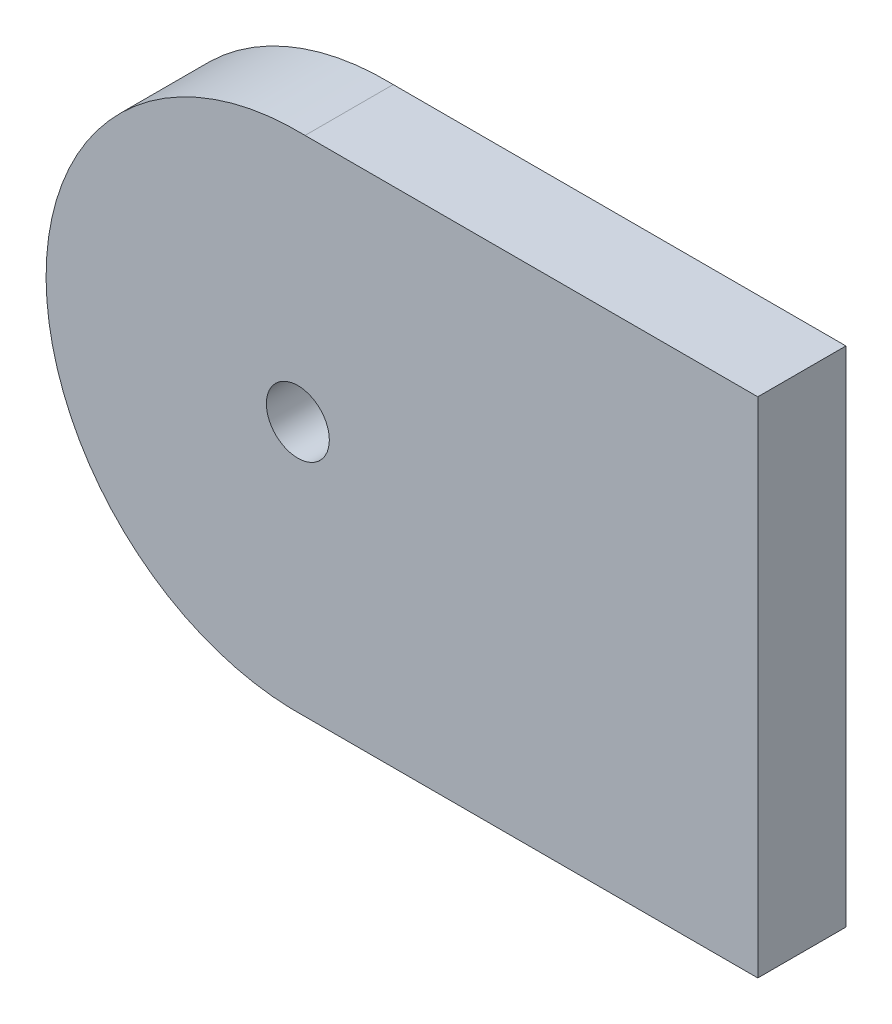
from build123d import *

# Parameters (mm, degrees)
BOSS_EXTRUDE1_DEPTH      = 8.89
BOSS_EXTRUDE1_DEPTH_BACK = 8.89
SKETCH1_R                = 6.35
SKETCH2_W                = 17.78
SKETCH2_H                = 101.558108624
BOSS_EXTRUDE2_DEPTH      = 76.2


with BuildPart() as part:
    # Sketch1 → Boss-Extrude1 (new, two sides: drawn at the far end of the back side and taken through both)
    with BuildSketch(Plane.XY.offset(-BOSS_EXTRUDE1_DEPTH_BACK)):
        with BuildLine():
            Line((1.458644289, 50.779054312), (16.603324728, 50.779054312))
            Line((16.603324728, 50.779054312), (16.603324728, -50.779054312))
            Line((16.603324728, -50.779054312), (-1.458644289, -50.779054312))
            ThreePointArc((-1.458644289, -50.779054312), (-50.779054312, 1.458644289), (1.458644289, 50.779054312))
        make_face()
        Circle(SKETCH1_R, mode=Mode.SUBTRACT)
    extrude(amount=BOSS_EXTRUDE1_DEPTH + BOSS_EXTRUDE1_DEPTH_BACK)

    # Sketch2 → Boss-Extrude2 (add)
    with BuildSketch(Plane(origin=(16.603324728, 0, 0), x_dir=(0, 0, -1), z_dir=(1, 0, 0))):
        Rectangle(SKETCH2_W, SKETCH2_H)
    extrude(amount=BOSS_EXTRUDE2_DEPTH)


solid = part.part
